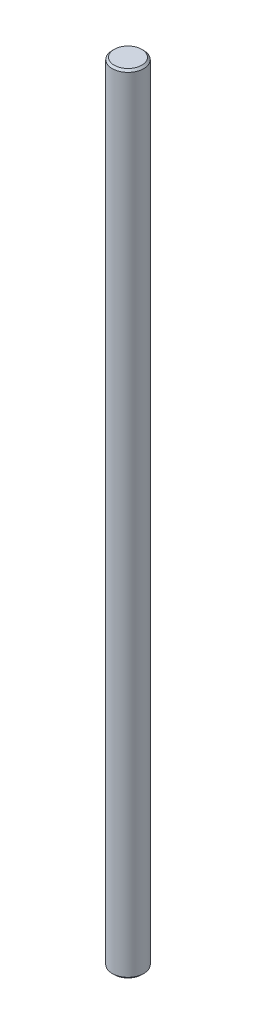
from build123d import *

# Parameters (mm, degrees)
SKETCH_1_R      = 4
EXTRUDE_1_DEPTH = 200
CHAMFER_1_SIZE  = 0.5


with BuildPart() as part:
    # Эскиз1 → Бобышка-Вытянуть1 (new body)
    with BuildSketch(Plane(origin=(0, 0, 0), x_dir=(1, 0, 0), z_dir=(0, 1, 0))):
        with Locations(Location((0, 0, 0), (0, 0, 270))):
            Circle(SKETCH_1_R)
    extrude(amount=EXTRUDE_1_DEPTH)

    # Фаска1
    chamfer_1_edges = [part.edges().sort_by_distance(p)[0] for p in [
        (0, 0, -4),
        (0, 200, -4),
    ]]
    chamfer(chamfer_1_edges, length=CHAMFER_1_SIZE)


solid = part.part
